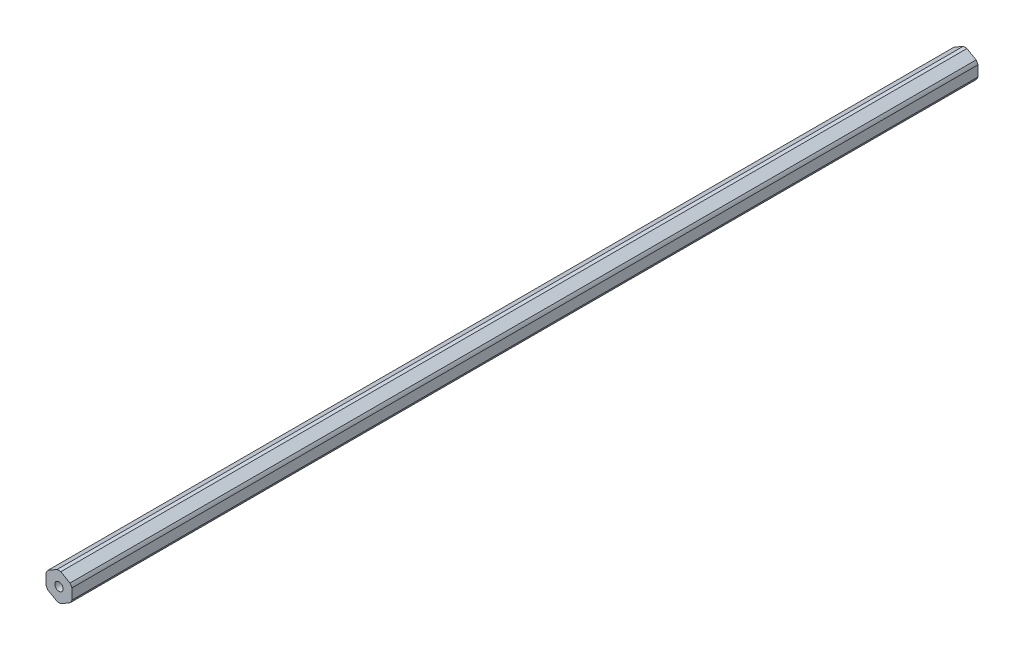
from build123d import *

# Parameters (mm, degrees)
BOSS_EXTRUDE1_DEPTH                  = 444.5
F_10_32_TAPPED_HOLE1_D               = 4.0386
F_10_32_TAPPED_HOLE1_DEPTH           = 15.07744
F_10_32_TAPPED_HOLE1_TIP             = 1.213317848
F_10_32_TAPPED_HOLE1_ON_FACE_2_D     = 4.0386
F_10_32_TAPPED_HOLE1_ON_FACE_2_DEPTH = 15.07744
F_10_32_TAPPED_HOLE1_ON_FACE_2_TIP   = 1.213317848


with BuildPart() as part:
    # Sketch1 → Boss-Extrude1 (new body)
    with BuildSketch(Plane.XY):
        with BuildLine():
            ThreePointArc((6.35, 2.590301913), (5.939202219, 3.429), (5.41826726, 4.204110358))
            Line((5.41826726, 4.204110358), (0.93173274, 6.79441227))
            ThreePointArc((0.93173274, 6.79441227), (0, 6.858), (-0.93173274, 6.79441227))
            Line((-0.93173274, 6.79441227), (-5.41826726, 4.204110358))
            ThreePointArc((-5.41826726, 4.204110358), (-5.939202219, 3.429), (-6.35, 2.590301913))
            Line((-6.35, 2.590301913), (-6.35, -2.590301913))
            ThreePointArc((-6.35, -2.590301913), (-5.939202219, -3.429), (-5.41826726, -4.204110358))
            Line((-5.41826726, -4.204110358), (-0.93173274, -6.79441227))
            ThreePointArc((-0.93173274, -6.79441227), (0, -6.858), (0.93173274, -6.79441227))
            Line((0.93173274, -6.79441227), (5.41826726, -4.204110358))
            ThreePointArc((5.41826726, -4.204110358), (5.939202219, -3.429), (6.35, -2.590301913))
            Line((6.35, -2.590301913), (6.35, 2.590301913))
        make_face()
    extrude(amount=BOSS_EXTRUDE1_DEPTH)

    # #10-32 Tapped Hole1
    with Locations(Plane.XY.offset(444.5)):
        with Locations((0, 0)):
            Hole(F_10_32_TAPPED_HOLE1_D / 2, depth=F_10_32_TAPPED_HOLE1_DEPTH)
            with Locations((0, 0, -(F_10_32_TAPPED_HOLE1_DEPTH + F_10_32_TAPPED_HOLE1_TIP / 2))):  # 118° drill point
                Cone(0, F_10_32_TAPPED_HOLE1_D / 2, F_10_32_TAPPED_HOLE1_TIP, mode=Mode.SUBTRACT)

    # #10-32 Tapped Hole1 on face 2
    with Locations(Plane(origin=(0, 0, 0), x_dir=(-1, 0, 0), z_dir=(0, 0, -1))):
        with Locations((0, 0)):
            Hole(F_10_32_TAPPED_HOLE1_ON_FACE_2_D / 2, depth=F_10_32_TAPPED_HOLE1_ON_FACE_2_DEPTH)
            with Locations((0, 0, -(F_10_32_TAPPED_HOLE1_ON_FACE_2_DEPTH + F_10_32_TAPPED_HOLE1_ON_FACE_2_TIP / 2))):  # 118° drill point
                Cone(0, F_10_32_TAPPED_HOLE1_ON_FACE_2_D / 2, F_10_32_TAPPED_HOLE1_ON_FACE_2_TIP, mode=Mode.SUBTRACT)


solid = part.part
